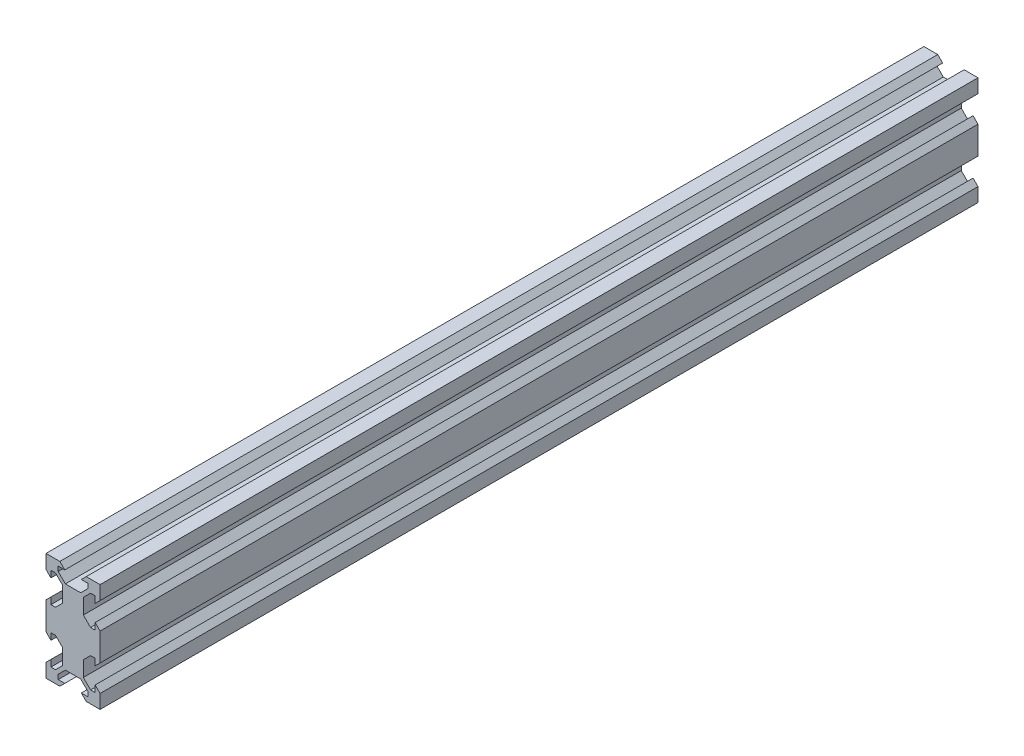
from build123d import *

# Parameters (mm, degrees)
SKETCH1_W           = 20
SKETCH1_H           = 40
BOSS_EXTRUDE1_DEPTH = 324.8
CUT_EXTRUDE1_DEPTH  = 328.864362199


with BuildPart() as part:
    # Sketch1 → Boss-Extrude1 (new body)
    with BuildSketch(Plane.XY):
        with Locations((10, 20)):
            Rectangle(SKETCH1_W, SKETCH1_H)
    extrude(amount=BOSS_EXTRUDE1_DEPTH)

    # Sketch2 → Cut-Extrude1 (cut, through all)
    with BuildSketch(Plane.XY.offset(324.8)):
        Polygon((5.12, 40), (6.94, 38.18), (4.5, 38.18), (4.5, 36.475807358), (7.165807358, 33.81), (12.834192642, 33.81), (15.5, 36.475807358), (15.5, 38.18), (13.06, 38.18), (14.88, 40), align=None)
        Polygon((18.18, 35.5), (18.18, 33.06), (20, 34.88), (20, 25.12), (18.18, 26.94), (18.18, 24.5), (16.475807358, 24.5), (13.81, 27.165807358), (13.81, 32.834192642), (16.475807358, 35.5), align=None)
        Polygon((20, 14.88), (18.18, 13.06), (18.18, 15.5), (16.475807358, 15.5), (13.81, 12.834192642), (13.81, 7.165807358), (16.475807358, 4.5), (18.18, 4.5), (18.18, 6.94), (20, 5.12), align=None)
        Polygon((15.5, 1.82), (13.06, 1.82), (14.88, 0), (5.12, 0), (6.94, 1.82), (4.5, 1.82), (4.5, 3.524192642), (7.165807358, 6.19), (12.834192642, 6.19), (15.5, 3.524192642), align=None)
        Polygon((1.82, 4.5), (1.82, 6.94), (0, 5.12), (0, 14.88), (1.82, 13.06), (1.82, 15.5), (3.524192642, 15.5), (6.19, 12.834192642), (6.19, 7.165807358), (3.524192642, 4.5), align=None)
        Polygon((0, 25.12), (1.82, 26.94), (1.82, 24.5), (3.524192642, 24.5), (6.19, 27.165807358), (6.19, 32.834192642), (3.524192642, 35.5), (1.82, 35.5), (1.82, 33.06), (0, 34.88), align=None)
    extrude(amount=-CUT_EXTRUDE1_DEPTH, mode=Mode.SUBTRACT)


solid = part.part
